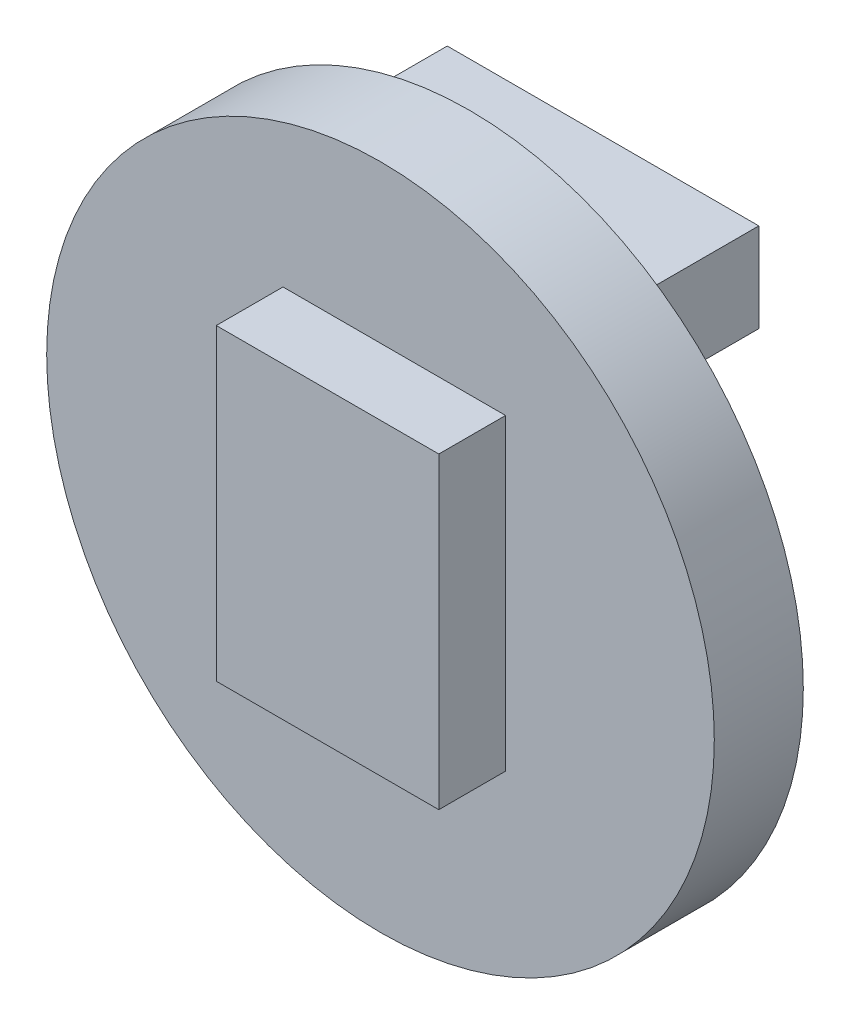
from build123d import *

# Parameters (mm, degrees)
SKETCH1_R           = 7.5
BOSS_EXTRUDE1_DEPTH = 2
SKETCH2_W           = 5
SKETCH2_H           = 6.920756948
BOSS_EXTRUDE2_DEPTH = 1.5
SKETCH3_W           = 7
SKETCH3_H           = 2
BOSS_EXTRUDE3_DEPTH = 3


with BuildPart() as part:
    # Sketch1 → Boss-Extrude1 (new body)
    with BuildSketch(Plane.XY):
        Circle(SKETCH1_R)
    extrude(amount=BOSS_EXTRUDE1_DEPTH)

    # Sketch2 → Boss-Extrude2 (add)
    with BuildSketch(Plane.XY.offset(2)):
        with Locations((0.310238116, 0.506092566)):
            Rectangle(SKETCH2_W, SKETCH2_H)
    extrude(amount=BOSS_EXTRUDE2_DEPTH)

    # Sketch3 → Boss-Extrude3 (add)
    with BuildSketch(Plane(origin=(0, 0, 0), x_dir=(-1, 0, 0), z_dir=(0, 0, -1))):
        with Locations((0, 4.5)):
            Rectangle(SKETCH3_W, SKETCH3_H)
    extrude(amount=BOSS_EXTRUDE3_DEPTH)


solid = part.part
